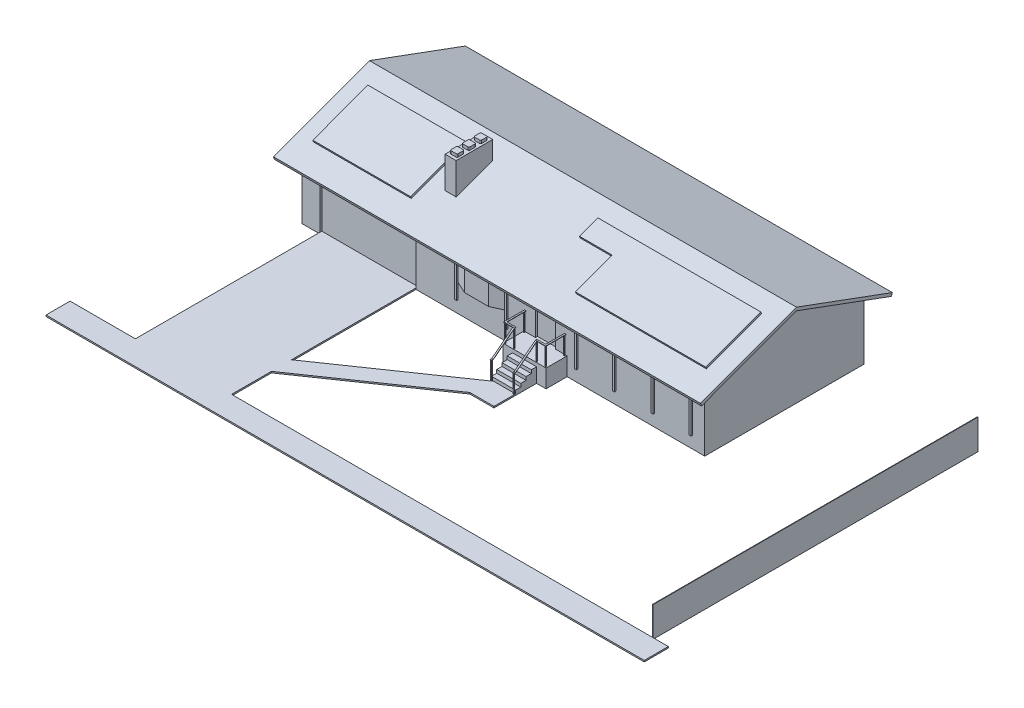
from build123d import *

# Parameters (mm, degrees)
SKETCH1_W            = 20421.6
SKETCH1_H            = 8077.2
BOSS_EXTRUDE1_DEPTH  = 3175
BOSS_EXTRUDE2_DEPTH  = 20421.6
BOSS_EXTRUDE3_DEPTH  = 609.6
BOSS_EXTRUDE4_DEPTH  = 609.6
SKETCH7_W            = 558.8
SKETCH7_H            = 1854.2
BOSS_EXTRUDE5_DEPTH  = 6165.342
CUT_EXTRUDE1_REACH   = 16472.135
SKETCH8_W            = 1854.2
SKETCH8_H            = 762.759056269
SKETCH9_W            = 1651
SKETCH9_H            = 990.6
BOSS_EXTRUDE6_DEPTH  = 101.6
SKETCH10_W           = 4876.8
SKETCH10_H           = 2438.4
SKETCH10_W_2         = 1828.8
SKETCH10_H_2         = 863.6
CUT_EXTRUDE2_DEPTH   = 101.6
BOSS_EXTRUDE7_DEPTH  = 1066.8
SKETCH10_4_W         = 2438.4
SKETCH10_4_H         = 1803.4
BOSS_EXTRUDE8_DEPTH  = 279.4
CUT_EXTRUDE3_REACH   = 12627.173
SKETCH10_5_W         = 1016
SKETCH10_5_H         = 2057.4
CUT_EXTRUDE4_DEPTH   = 101.6
SKETCH12_W           = 1219.2
SKETCH12_H           = 730.25
BOSS_EXTRUDE9_DEPTH  = 1066.8
CUT_EXTRUDE5_REACH   = 15863.9
SKETCH14_W           = 1219.2
SKETCH14_H           = 69.85
BOSS_EXTRUDE10_DEPTH = 1092.2
SKETCH15_W           = 4876.8
SKETCH15_H           = 69.85
BOSS_EXTRUDE11_DEPTH = 9448.8
BOSS_EXTRUDE12_DEPTH = 69.85
SKETCH17_W           = 30319.567993751
SKETCH17_H           = 69.85
BOSS_EXTRUDE13_DEPTH = 1219.2
SKETCH18_W           = 101.6
SKETCH18_H           = 2565.4
BOSS_EXTRUDE14_DEPTH = 76.2
SKETCH19_W           = 38.1
SKETCH19_H           = 38.1
BOSS_EXTRUDE15_DEPTH = 914.4
SKETCH20_W           = 76.2
SKETCH20_H           = 1064.05115811
SKETCH20_W_2         = 38.1
SKETCH20_H_2         = 38.1
SKETCH20_W_3         = 465.536600387
SKETCH20_H_3         = 76.2
SKETCH20_W_4         = 442.214422423
SKETCH20_H_4         = 1028.7
BOSS_EXTRUDE17_DEPTH = 19.05
SKETCH21_W           = 38.1
SKETCH21_H           = 38.1
BOSS_EXTRUDE18_DEPTH = 914.4
SKETCH22_W           = 76.2
SKETCH22_H           = 76.2
BOSS_EXTRUDE19_DEPTH = 19.05
BOSS_EXTRUDE20_DEPTH = 152.4
SKETCH25_W           = 25.4
SKETCH25_H           = 16465.752979385
BOSS_EXTRUDE21_DEPTH = 1524


with BuildPart() as part:
    # Sketch1 → Boss-Extrude1 (new body)
    with BuildSketch(Plane(origin=(0, 0, 0), x_dir=(1, 0, 0), z_dir=(0, 1, 0))):
        Rectangle(SKETCH1_W, SKETCH1_H)
    extrude(amount=BOSS_EXTRUDE1_DEPTH)

    # Sketch2 → Boss-Extrude2 (add)
    with BuildSketch(Plane(origin=(10210.8, 0, 0), x_dir=(0, 0, -1), z_dir=(1, 0, 0))):
        Polygon((-4809.568311922, 2891.020209746), (-4038.6, 3175), (4038.6, 3175), (4809.568311922, 2891.020209746), (4862.243818601, 3034.027380881), (0, 4824.994607963), (-4862.243818601, 3034.027380881), align=None)
    extrude(amount=-BOSS_EXTRUDE2_DEPTH)

    # Sketch3 → Boss-Extrude3 (add)
    with BuildSketch(Plane(origin=(10210.8, 0, 0), x_dir=(0, 0, -1), z_dir=(1, 0, 0))):
        Polygon((-4862.243818601, 3034.027380881), (-4809.568311922, 2891.020209746), (0, 4662.584850357), (4809.568311922, 2891.020209746), (4862.243818601, 3034.027380881), (0, 4824.994607963), align=None)
    extrude(amount=BOSS_EXTRUDE3_DEPTH)

    # Sketch4 → Boss-Extrude4 (add)
    with BuildSketch(Plane.ZY.offset(10210.8)):
        Polygon((-4862.243818601, 3034.027380881), (0, 4824.994607963), (4862.243818601, 3034.027380881), (4809.568311922, 2891.020209746), (0, 4662.584850357), (-4809.568311922, 2891.020209746), align=None)
    extrude(amount=BOSS_EXTRUDE4_DEPTH)

    # Sketch7 → Boss-Extrude5 (add)
    with BuildSketch(Plane(origin=(0, 0, 0), x_dir=(1, 0, 0), z_dir=(0, 1, 0))):
        with Locations((-3937, -1841.5)):
            Rectangle(SKETCH7_W, SKETCH7_H)
    extrude(amount=BOSS_EXTRUDE5_DEPTH)

    # Sketch8 → Cut-Extrude1 (cut, up to next)
    with BuildSketch(Plane(origin=(-3657.6, 0, 0), x_dir=(0, 0, -1), z_dir=(1, 0, 0)), mode=Mode.PRIVATE) as cut_extrude1_sk1:
        with Locations((-1841.5, 5783.962471866)):
            Rectangle(SKETCH8_W, SKETCH8_H)
    cut_extrude1_tool1 = extrude(cut_extrude1_sk1.sketch, amount=-CUT_EXTRUDE1_REACH, mode=Mode.PRIVATE) & part.part
    add(cut_extrude1_tool1.solids().sort_by_distance((-3657.6, 5783.962472, 1841.5))[0], mode=Mode.SUBTRACT)

    # Sketch9 → Boss-Extrude6 (add)
    with BuildSketch(Plane(origin=(0, 4248.567572535, 1564.924666127), x_dir=(1, 0, 0), z_dir=(0, 0.9383672646673883, 0.3456398076041643))):
        with Locations((-9182.1, 258.010207987)):
            Rectangle(SKETCH9_W, SKETCH9_H)
        with Locations((-7531.1, 258.010207987)):
            Rectangle(SKETCH9_W, SKETCH9_H)
        with Locations((-5880.1, 258.010207987)):
            Rectangle(SKETCH9_W, SKETCH9_H)
        with Locations((-9182.1, -732.589792013)):
            Rectangle(SKETCH9_W, SKETCH9_H)
        with Locations((-7531.1, -732.589792013)):
            Rectangle(SKETCH9_W, SKETCH9_H)
        with Locations((-5880.1, -732.589792013)):
            Rectangle(SKETCH9_W, SKETCH9_H)
        with Locations((-9182.1, -1723.189792013)):
            Rectangle(SKETCH9_W, SKETCH9_H)
        with Locations((-7531.1, -1723.189792013)):
            Rectangle(SKETCH9_W, SKETCH9_H)
        with Locations((-5880.1, -1723.189792013)):
            Rectangle(SKETCH9_W, SKETCH9_H)
        with Locations((2476.5, 258.010207987)):
            Rectangle(SKETCH9_W, SKETCH9_H)
        with Locations((4127.5, 258.010207987)):
            Rectangle(SKETCH9_W, SKETCH9_H)
        with Locations((4127.5, -732.589792013)):
            Rectangle(SKETCH9_W, SKETCH9_H)
        with Locations((4127.5, -1723.189792013)):
            Rectangle(SKETCH9_W, SKETCH9_H)
        with Locations((5778.5, -1723.189792013)):
            Rectangle(SKETCH9_W, SKETCH9_H)
        with Locations((5778.5, -732.589792013)):
            Rectangle(SKETCH9_W, SKETCH9_H)
        with Locations((5778.5, 258.010207987)):
            Rectangle(SKETCH9_W, SKETCH9_H)
        with Locations((7429.5, 258.010207987)):
            Rectangle(SKETCH9_W, SKETCH9_H)
        with Locations((7429.5, -732.589792013)):
            Rectangle(SKETCH9_W, SKETCH9_H)
        with Locations((7429.5, -1723.189792013)):
            Rectangle(SKETCH9_W, SKETCH9_H)
        with Locations((9080.5, -1723.189792013)):
            Rectangle(SKETCH9_W, SKETCH9_H)
        with Locations((9080.5, -732.589792013)):
            Rectangle(SKETCH9_W, SKETCH9_H)
        with Locations((9080.5, 258.010207987)):
            Rectangle(SKETCH9_W, SKETCH9_H)
    extrude(amount=BOSS_EXTRUDE6_DEPTH)

    # Sketch10 → Cut-Extrude2 (cut)
    with BuildSketch(Plane.XY.offset(4038.6)):
        with Locations((-6858, 1219.2)):
            Rectangle(SKETCH10_W, SKETCH10_H)
        with Locations((4699, 2565.4)):
            Rectangle(SKETCH10_W_2, SKETCH10_H_2)
        with Locations((8585.2, 2565.4)):
            Rectangle(SKETCH10_W_2, SKETCH10_H_2)
    extrude(amount=-CUT_EXTRUDE2_DEPTH, mode=Mode.SUBTRACT)

    # Sketch10<3> → Boss-Extrude7 (add)
    with BuildSketch(Plane.XY.offset(4038.6)):
        Polygon((1054.1, 914.4), (1054.1, 0), (3238.5, 0), (3238.5, 914.4), (2654.3, 914.4), (1638.3, 914.4), align=None)
    extrude(amount=BOSS_EXTRUDE7_DEPTH)

    # Sketch10<4> → Boss-Extrude8 (add)
    with BuildSketch(Plane.XY.offset(4038.6)):
        with Locations((-1066.8, 2273.3)):
            Rectangle(SKETCH10_4_W, SKETCH10_4_H)
    extrude(amount=BOSS_EXTRUDE8_DEPTH)

    # Cut-Extrude3: up to this plane
    cut_extrude3_end = Plane(origin=(-20125.734027972, 2891.020209746, 4809.568311922), z_dir=(0, -0.9383672646673882, -0.3456398076041645))
    # Sketch11 → Cut-Extrude3 (cut, up to the surface)
    with BuildSketch(Plane.XZ.offset(-1371.6), mode=Mode.PRIVATE) as cut_extrude3_sk1:
        Polygon((-1676.4, 4318), (-2286, 4038.6), (-2286, 4318), align=None)
    cut_extrude3_tool1 = split(extrude(cut_extrude3_sk1.sketch, amount=-CUT_EXTRUDE3_REACH, mode=Mode.PRIVATE), bisect_by=cut_extrude3_end, keep=Keep.BOTH, mode=Mode.PRIVATE)
    add(cut_extrude3_tool1.solids().sort_by_distance((-2082.8, 1371.6, 4224.866667))[0], mode=Mode.SUBTRACT)
    # Sketch11 → Cut-Extrude3 (cut, up to the surface)
    with BuildSketch(Plane.XZ.offset(-1371.6), mode=Mode.PRIVATE) as cut_extrude3_sk2:
        Polygon((152.4, 4038.6), (-457.2, 4318), (152.4, 4318), align=None)
    cut_extrude3_tool2 = split(extrude(cut_extrude3_sk2.sketch, amount=-CUT_EXTRUDE3_REACH, mode=Mode.PRIVATE), bisect_by=cut_extrude3_end, keep=Keep.BOTH, mode=Mode.PRIVATE)
    add(cut_extrude3_tool2.solids().sort_by_distance((-50.8, 1371.6, 4224.866667))[0], mode=Mode.SUBTRACT)

    # Sketch10<5> → Cut-Extrude4 (cut)
    with BuildSketch(Plane.XY.offset(4038.6)):
        with Locations((2146.3, 1943.1)):
            Rectangle(SKETCH10_5_W, SKETCH10_5_H)
    extrude(amount=-CUT_EXTRUDE4_DEPTH, mode=Mode.SUBTRACT)

    # Sketch12 → Boss-Extrude9 (add)
    with BuildSketch(Plane.XY.offset(5105.4)):
        with Locations((2146.3, 365.125)):
            Rectangle(SKETCH12_W, SKETCH12_H)
    extrude(amount=BOSS_EXTRUDE9_DEPTH)

    # Sketch13 → Cut-Extrude5 (cut, up to next)
    with BuildSketch(Plane(origin=(2755.9, 0, 0), x_dir=(0, 0, -1), z_dir=(1, 0, 0)), mode=Mode.PRIVATE) as cut_extrude5_sk1:
        Polygon((-5372.1, 730.25), (-5372.1, 565.15), (-5638.8, 565.15), (-5638.8, 400.05), (-5905.5, 400.05), (-5905.5, 234.95), (-6172.2, 234.95), (-6172.2, 730.25), align=None)
    cut_extrude5_tool1 = extrude(cut_extrude5_sk1.sketch, amount=-CUT_EXTRUDE5_REACH, mode=Mode.PRIVATE) & part.part
    add(cut_extrude5_tool1.solids().sort_by_distance((2755.9, 537.633333, 5861.05))[0], mode=Mode.SUBTRACT)

    # Sketch14 → Boss-Extrude10 (add)
    with BuildSketch(Plane.XY.offset(6172.2)):
        with Locations((2146.3, 34.925)):
            Rectangle(SKETCH14_W, SKETCH14_H)
    extrude(amount=BOSS_EXTRUDE10_DEPTH)

    # Sketch15 → Boss-Extrude11 (add)
    with BuildSketch(Plane.XY.offset(3937)):
        with Locations((-6858, 34.925)):
            Rectangle(SKETCH15_W, SKETCH15_H)
    extrude(amount=BOSS_EXTRUDE11_DEPTH)

    # Sketch16 → Boss-Extrude12 (add)
    with BuildSketch(Plane(origin=(0, 0, 0), x_dir=(1, 0, 0), z_dir=(0, 1, 0))):
        Polygon((1536.7, -7264.4), (-4419.6, -11364.643818601), (-4419.6, -10348.643818601), (1536.7, -6248.4), align=None)
    extrude(amount=BOSS_EXTRUDE12_DEPTH)

    # Sketch17 → Boss-Extrude13 (add)
    with BuildSketch(Plane.XY.offset(13385.8)):
        with Locations((2553.982554277, 34.925)):
            Rectangle(SKETCH17_W, SKETCH17_H)
    extrude(amount=BOSS_EXTRUDE13_DEPTH)

    # Sketch18 → Boss-Extrude14 (add)
    with BuildSketch(Plane.XY.offset(4038.6)):
        with Locations((3733.8, 1892.3)):
            Rectangle(SKETCH18_W, SKETCH18_H)
        with Locations((5664.2, 1892.3)):
            Rectangle(SKETCH18_W, SKETCH18_H)
        with Locations((7620, 1892.3)):
            Rectangle(SKETCH18_W, SKETCH18_H)
        with Locations((9550.4, 1892.3)):
            Rectangle(SKETCH18_W, SKETCH18_H)
        with Locations((-2336.8, 1892.3)):
            Rectangle(SKETCH18_W, SKETCH18_H)
        with Locations((203.2, 1892.3)):
            Rectangle(SKETCH18_W, SKETCH18_H)
    extrude(amount=BOSS_EXTRUDE14_DEPTH)

    # Sketch19 → Boss-Extrude15 (add)
    with BuildSketch(Plane(origin=(0, 914.4, 0), x_dir=(1, 0, 0), z_dir=(0, 1, 0))):
        with Locations((1111.25, -5048.25)):
            Rectangle(SKETCH19_W, SKETCH19_H)
        with Locations((3157.549482504, -5048.25)):
            Rectangle(SKETCH19_W, SKETCH19_H)
        with Locations((3157.549482504, -4095.75)):
            Rectangle(SKETCH19_W, SKETCH19_H)
        with Locations((1111.25, -4095.75)):
            Rectangle(SKETCH19_W, SKETCH19_H)
        with Locations((1576.786600387, -5048.25)):
            Rectangle(SKETCH19_W, SKETCH19_H)
        with Locations((2715.335060081, -5048.25)):
            Rectangle(SKETCH19_W, SKETCH19_H)
    extrude(amount=BOSS_EXTRUDE15_DEPTH)

    # Sketch20 → Boss-Extrude17 (add)
    # profile 1 of 5: a face of its own
    with BuildSketch(Plane(origin=(0, 1828.8, 0), x_dir=(1, 0, 0), z_dir=(0, 1, 0))):
        with Locations((1111.25, -4554.324420945)):
            Rectangle(SKETCH20_W, SKETCH20_H)
        with Locations((1111.25, -4095.75)):
            Rectangle(SKETCH20_W_2, SKETCH20_H_2, mode=Mode.SUBTRACT)
    # profile 2 of 5: a face of its own
    with BuildSketch(Plane(origin=(0, 1828.8, 0), x_dir=(1, 0, 0), z_dir=(0, 1, 0))):
        with Locations((1382.118300194, -5048.25)):
            Rectangle(SKETCH20_W_3, SKETCH20_H_3)
    # profile 3 of 5: a face of its own
    with BuildSketch(Plane(origin=(0, 1828.8, 0), x_dir=(1, 0, 0), z_dir=(0, 1, 0))):
        with Locations((2898.342271293, -5048.25)):
            Rectangle(SKETCH20_W_4, SKETCH20_H_3)
    # profile 4 of 5: a face of its own
    with BuildSketch(Plane(origin=(0, 1828.8, 0), x_dir=(1, 0, 0), z_dir=(0, 1, 0))):
        with Locations((3157.549482504, -4572)):
            Rectangle(SKETCH20_W, SKETCH20_H_4)
    # profile 5 of 5: a face of its own
    with BuildSketch(Plane(origin=(0, 1828.8, 0), x_dir=(1, 0, 0), z_dir=(0, 1, 0))):
        with Locations((1111.25, -4095.75)):
            Rectangle(SKETCH20_W_2, SKETCH20_H_2)
    extrude(amount=BOSS_EXTRUDE17_DEPTH)

    # Sketch21 → Boss-Extrude18 (add)
    with BuildSketch(Plane(origin=(0, 69.85, 0), x_dir=(1, 0, 0), z_dir=(0, 1, 0))):
        with Locations((1576.786600387, -6210.3)):
            Rectangle(SKETCH21_W, SKETCH21_H)
        with Locations((2715.335060081, -6210.3)):
            Rectangle(SKETCH21_W, SKETCH21_H)
    extrude(amount=BOSS_EXTRUDE18_DEPTH)

    # Sketch22 → Boss-Extrude19 (add)
    with BuildSketch(Plane(origin=(0, 984.25, 0), x_dir=(1, 0, 0), z_dir=(0, 1, 0))):
        with Locations((1576.786600387, -6210.3)):
            Rectangle(SKETCH22_W, SKETCH22_H)
        with Locations((2715.335060081, -6210.3)):
            Rectangle(SKETCH22_W, SKETCH22_H)
    extrude(amount=BOSS_EXTRUDE19_DEPTH)

    # Sketch23 → section 0 of loft1
    with BuildSketch(Plane.XY.offset(5086.35), mode=Mode.PRIVATE) as loft1_s0:
        with BuildLine():
            Line((1614.886600387, 1828.8), (1538.686600387, 1828.8))
            Line((1538.686600387, 1828.8), (1538.686600387, 1847.85))
            Line((1538.686600387, 1847.85), (1614.886600387, 1847.85))
            Line((1614.886600387, 1847.85), (1614.886600387, 1828.8))
        make_face()
    # loft up to a face of the part (loft1)
    loft([loft1_s0.sketch, part.faces().sort_by_distance((1576.786600387, 993.775, 6172.2))[0]])

    # Sketch23<5> → section 1 of loft3
    with BuildSketch(Plane.XY.offset(5086.35), mode=Mode.PRIVATE) as loft3_s1:
        with BuildLine():
            Line((2677.235060081, 1828.8), (2753.435060081, 1828.8))
            Line((2753.435060081, 1828.8), (2753.435060081, 1847.85))
            Line((2753.435060081, 1847.85), (2677.235060081, 1847.85))
            Line((2677.235060081, 1847.85), (2677.235060081, 1828.8))
        make_face()
    # loft from a face of the part (loft3)
    loft([part.faces().sort_by_distance((2715.335060081, 993.775, 6172.2))[0], loft3_s1.sketch])

    # Sketch24 → Boss-Extrude20 (add)
    with BuildSketch(Plane(origin=(0, 5402.582943731, 0), x_dir=(1, 0, 0), z_dir=(0, 1, 0))):
        with BuildLine():
            Line((-4064, -1066.8), (-3810, -1066.8))
            ThreePointArc((-3810, -1066.8), (-3774.078975516, -1081.678975516), (-3759.2, -1117.6))
            Line((-3759.2, -1117.6), (-3759.2, -1371.6))
            ThreePointArc((-3759.2, -1371.6), (-3774.078975516, -1407.521024484), (-3810, -1422.4))
            Line((-3810, -1422.4), (-4064, -1422.4))
            ThreePointArc((-4064, -1422.4), (-4099.921024484, -1407.521024484), (-4114.8, -1371.6))
            Line((-4114.8, -1371.6), (-4114.8, -1117.6))
            ThreePointArc((-4114.8, -1117.6), (-4099.921024484, -1081.678975516), (-4064, -1066.8))
        make_face()
        with BuildLine():
            Line((-4064, -1663.7), (-3810, -1663.7))
            ThreePointArc((-3810, -1663.7), (-3774.078975516, -1678.578975516), (-3759.2, -1714.5))
            Line((-3759.2, -1714.5), (-3759.2, -1968.5))
            ThreePointArc((-3759.2, -1968.5), (-3774.078975516, -2004.421024484), (-3810, -2019.3))
            Line((-3810, -2019.3), (-4064, -2019.3))
            ThreePointArc((-4064, -2019.3), (-4099.921024484, -2004.421024484), (-4114.8, -1968.5))
            Line((-4114.8, -1968.5), (-4114.8, -1714.5))
            ThreePointArc((-4114.8, -1714.5), (-4099.921024484, -1678.578975516), (-4064, -1663.7))
        make_face()
        with BuildLine():
            Line((-4064, -2260.6), (-3810, -2260.6))
            ThreePointArc((-3810, -2260.6), (-3774.078975516, -2275.478975516), (-3759.2, -2311.4))
            Line((-3759.2, -2311.4), (-3759.2, -2565.4))
            ThreePointArc((-3759.2, -2565.4), (-3774.078975516, -2601.321024484), (-3810, -2616.2))
            Line((-3810, -2616.2), (-4064, -2616.2))
            ThreePointArc((-4064, -2616.2), (-4099.921024484, -2601.321024484), (-4114.8, -2565.4))
            Line((-4114.8, -2565.4), (-4114.8, -2311.4))
            ThreePointArc((-4114.8, -2311.4), (-4099.921024484, -2275.478975516), (-4064, -2260.6))
        make_face()
    extrude(amount=BOSS_EXTRUDE20_DEPTH)

    # Sketch25 → Boss-Extrude21 (add)
    with BuildSketch(Plane(origin=(0, 0, 0), x_dir=(1, 0, 0), z_dir=(0, 1, 0))):
        with Locations((16929.1, -5152.923510308)):
            Rectangle(SKETCH25_W, SKETCH25_H)
    extrude(amount=BOSS_EXTRUDE21_DEPTH)


solid = part.part
